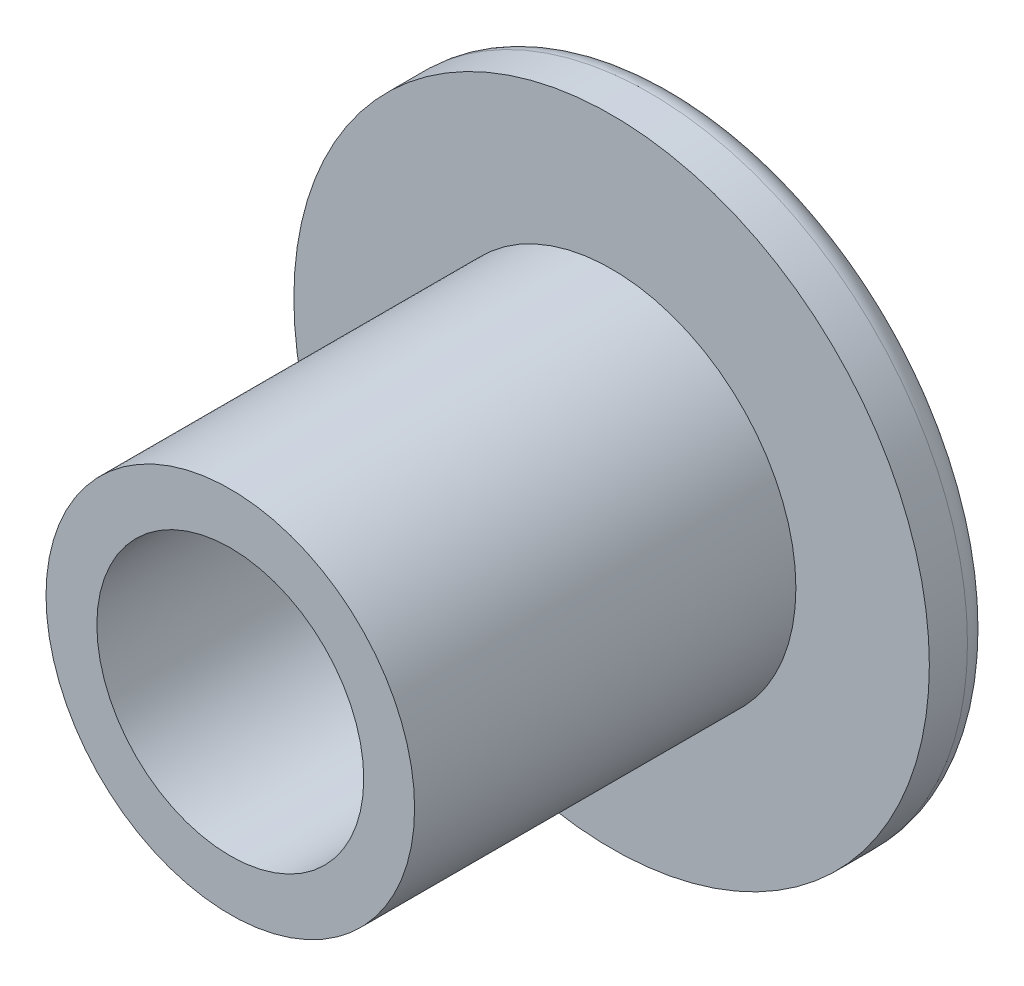
from build123d import *

# Parameters (mm, degrees)
SKETCH1_R               = 5
BOSS_EXTRUDE1_DEPTH     = 1
SKETCH2_R               = 2.9
BOSS_EXTRUDE2_DEPTH     = 6
CUT_EXTRUDE2_DEPTH      = 10.949874371
CUT_EXTRUDE2_DEPTH_BACK = 10.949874371
SKETCH3_R               = 2.1
FILLET1_R               = 0.4
FILLET2_R               = 0.2


with BuildPart() as part:
    # Sketch1 → Boss-Extrude1 (new body)
    with BuildSketch(Plane.XY):
        Circle(SKETCH1_R)
    extrude(amount=BOSS_EXTRUDE1_DEPTH)

    # Sketch2 → Boss-Extrude2 (add)
    with BuildSketch(Plane.XY.offset(1)):
        Circle(SKETCH2_R)
    extrude(amount=BOSS_EXTRUDE2_DEPTH)

    # Sketch3 → Cut-Extrude2 (cut, two sides: drawn at the far end of the back side and taken through both)
    with BuildSketch(Plane.XY.offset(7).offset(-CUT_EXTRUDE2_DEPTH_BACK)):
        Circle(SKETCH3_R)
    extrude(amount=CUT_EXTRUDE2_DEPTH + CUT_EXTRUDE2_DEPTH_BACK, mode=Mode.SUBTRACT)

    # Fillet1
    fillet1_edges = [part.edges().sort_by_distance(p)[0] for p in [
        (-5, 0, 0),
    ]]
    fillet(fillet1_edges, radius=FILLET1_R)

    # Fillet2
    fillet2_edges = [part.edges().sort_by_distance(p)[0] for p in [
        (-2.1, 0, 0),
    ]]
    fillet(fillet2_edges, radius=FILLET2_R)


solid = part.part
